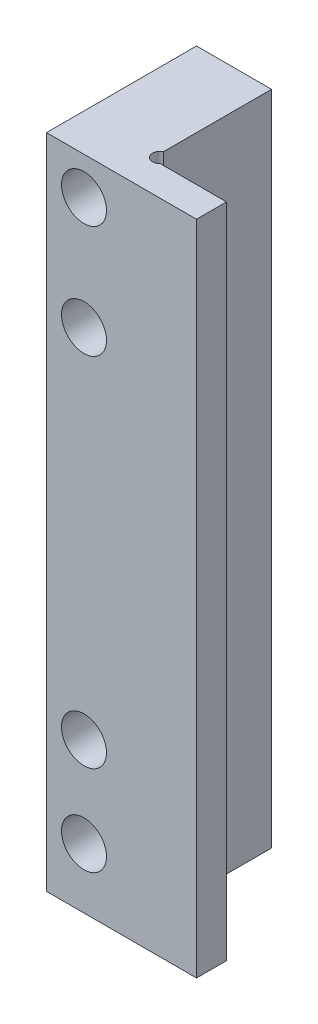
from build123d import *

# Parameters (mm, degrees)
SKETCH_1_W          = 10
SKETCH_1_H          = 43.8
EXTRUDE_1_DEPTH     = 10
SKETCH_2_R          = 0.5
SKETCH_2_W          = 5
SKETCH_2_H          = 8
CUT_EXTRUDE_1_DEPTH = 57.889805765
SKETCH_3_R          = 1.5
CUT_EXTRUDE_2_DEPTH = 43.398349024
SKETCH_4_R          = 1.5
CUT_EXTRUDE_3_DEPTH = 5


with BuildPart() as part:
    # 草圖1 → 填料-伸長1 (new body)
    with BuildSketch(Plane.XY):
        with Locations((-29.9, 0)):
            Rectangle(SKETCH_1_W, SKETCH_1_H)
    extrude(amount=-EXTRUDE_1_DEPTH)

    # 草圖2 → 除料-伸長1 (cut, through all)
    with BuildSketch(Plane.XZ.offset(21.9)):
        with Locations((-29.683988881, -2.34561779)):
            Circle(SKETCH_2_R)
        with Locations((-27.4, -6)):
            Rectangle(SKETCH_2_W, SKETCH_2_H)
    extrude(amount=-CUT_EXTRUDE_1_DEPTH, mode=Mode.SUBTRACT)

    # 草圖3 → 除料-伸長2 (cut, through all)
    with BuildSketch(Plane.XY):
        with Locations((-32.4, -17.9)):
            Circle(SKETCH_3_R)
        with Locations((-32.4, 19.4)):
            Circle(SKETCH_3_R)
    extrude(amount=-CUT_EXTRUDE_2_DEPTH, mode=Mode.SUBTRACT)

    # 草圖4 → 除料-伸長3 (cut)
    with BuildSketch(Plane.XY):
        with Locations((-32.4, 11.9)):
            Circle(SKETCH_4_R)
        with Locations(Location((-32.4, -11.9, 0), (0, 0, 180))):
            Circle(SKETCH_4_R)
    extrude(amount=-CUT_EXTRUDE_3_DEPTH, mode=Mode.SUBTRACT)


solid = part.part
